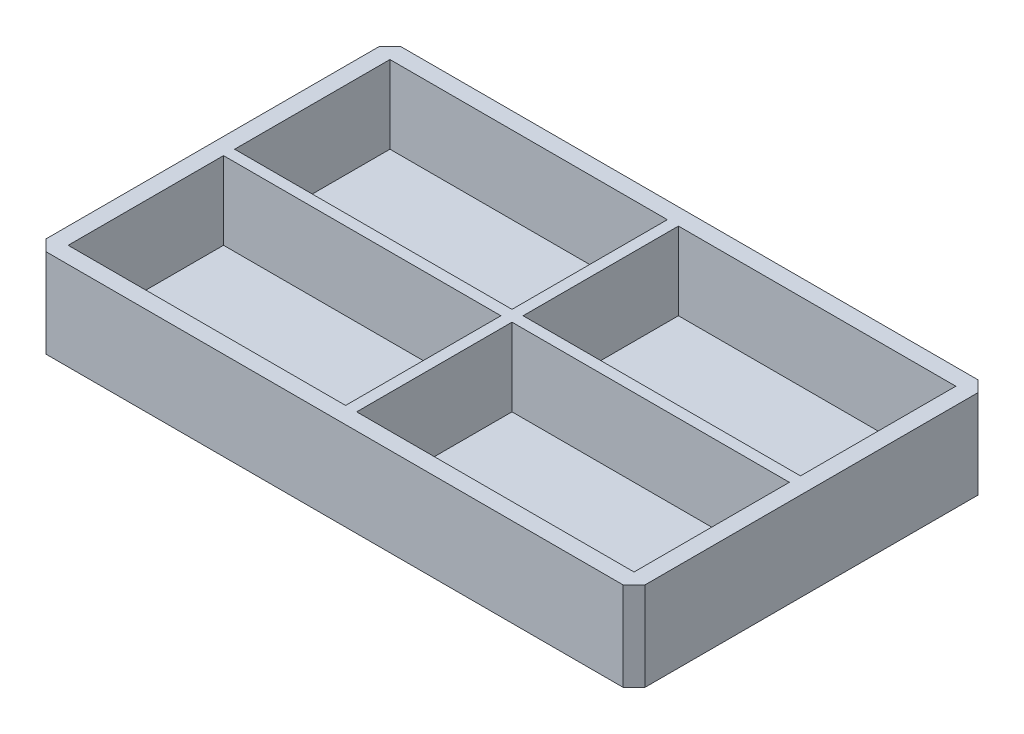
from build123d import *

# Parameters (mm, degrees)
SKETCH1_W           = 54
SKETCH1_H           = 32
SKETCH1_W_2         = 25
SKETCH1_H_2         = 14
BOSS_EXTRUDE1_DEPTH = 7
SKETCH2_W           = 54
SKETCH2_H           = 32
BOSS_EXTRUDE2_DEPTH = 1
CHAMFER1_SIZE       = 1


with BuildPart() as part:
    # Sketch1 → Boss-Extrude1 (new body)
    with BuildSketch(Plane(origin=(0, 0, 0), x_dir=(1, 0, 0), z_dir=(0, 1, 0))):
        with Locations((1.304347826, -0.359533527)):
            Rectangle(SKETCH1_W, SKETCH1_H)
        with Locations((-11.695652174, 7.140466473)):
            Rectangle(SKETCH1_W_2, SKETCH1_H_2, mode=Mode.SUBTRACT)
        with Locations((-11.695652174, -7.859533527)):
            Rectangle(SKETCH1_W_2, SKETCH1_H_2, mode=Mode.SUBTRACT)
        with Locations((14.304347826, 7.140466473)):
            Rectangle(SKETCH1_W_2, SKETCH1_H_2, mode=Mode.SUBTRACT)
        with Locations((14.304347826, -7.859533527)):
            Rectangle(SKETCH1_W_2, SKETCH1_H_2, mode=Mode.SUBTRACT)
    extrude(amount=BOSS_EXTRUDE1_DEPTH)

    # Sketch2 → Boss-Extrude2 (add)
    with BuildSketch(Plane.XZ):
        with Locations((1.304347826, 0.359533527)):
            Rectangle(SKETCH2_W, SKETCH2_H)
    extrude(amount=BOSS_EXTRUDE2_DEPTH)

    # Chamfer1
    chamfer1_edges = [part.edges().sort_by_distance(p)[0] for p in [
        (-25.695652174, 3, -15.640466473),
        (28.304347826, 3, -15.640466473),
        (28.304347826, 3, 16.359533527),
        (-25.695652174, 3, 16.359533527),
    ]]
    chamfer(chamfer1_edges, length=CHAMFER1_SIZE)


solid = part.part
